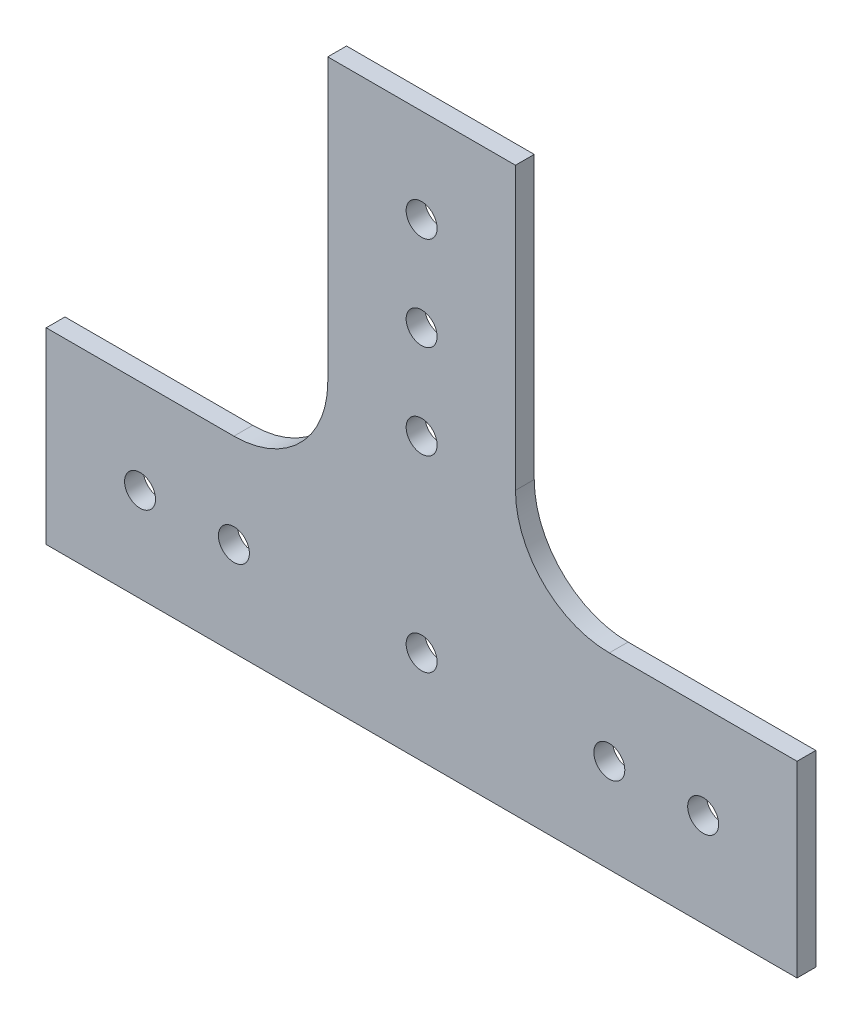
from build123d import *

# Parameters (mm, degrees)
SKETCH_1_R      = 1.65
EXTRUDE_1_DEPTH = 2
FILLET_1_R      = 10


with BuildPart() as part:
    # 草图1 → 凸台-拉伸1 (new body)
    with BuildSketch(Plane.XY):
        Polygon((10, 10), (30, 10), (40, 10), (40, -10), (30, -10), (-30, -10), (-40, -10), (-40, 10), (-30, 10), (-10, 10), (-10, 50), (10, 50), align=None)
        Circle(SKETCH_1_R, mode=Mode.SUBTRACT)
        with Locations((-20, 0)):
            Circle(SKETCH_1_R, mode=Mode.SUBTRACT)
        with Locations((20, 0)):
            Circle(SKETCH_1_R, mode=Mode.SUBTRACT)
        with Locations((0, 20)):
            Circle(SKETCH_1_R, mode=Mode.SUBTRACT)
        with Locations((0, 30)):
            Circle(SKETCH_1_R, mode=Mode.SUBTRACT)
        with Locations((0, 40)):
            Circle(SKETCH_1_R, mode=Mode.SUBTRACT)
        with Locations((30, 0)):
            Circle(SKETCH_1_R, mode=Mode.SUBTRACT)
        with Locations((-30, 0)):
            Circle(SKETCH_1_R, mode=Mode.SUBTRACT)
    extrude(amount=EXTRUDE_1_DEPTH)

    # 圆角1
    fillet_1_edges = [part.edges().sort_by_distance(p)[0] for p in [
        (-10, 10, 1),
        (10, 10, 1),
    ]]
    fillet(fillet_1_edges, radius=FILLET_1_R)


solid = part.part
